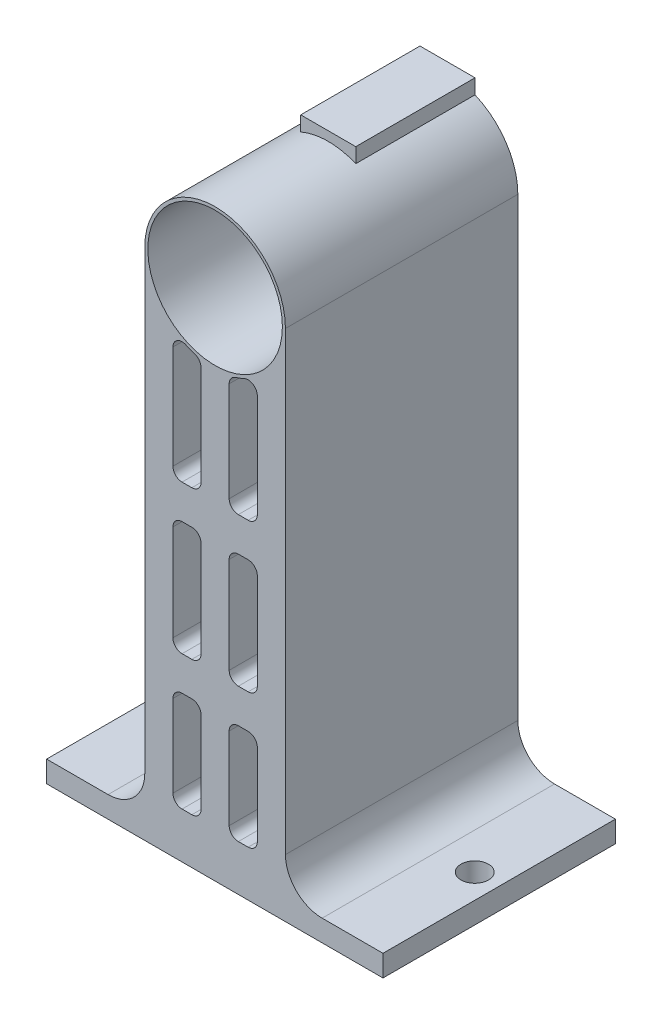
from build123d import *

# Parameters (mm, degrees)
CROQUIS1_R              = 11.5
CROQUIS1_R_2            = 11
SALIENTE_EXTRUIR1_DEPTH = 19
SALIENTE_EXTRUIR2_DEPTH = 0.5
SALIENTE_EXTRUIR3_START = 19
SALIENTE_EXTRUIR3_DEPTH = 19
SALIENTE_EXTRUIR4_START = -38
CROQUIS4_W              = 4.6
CROQUIS4_H              = 16.4
CROQUIS4_H_2            = 18.7
SALIENTE_EXTRUIR4_DEPTH = 38
CROQUIS5_R              = 2.25
CORTAR_EXTRUIR1_DEPTH   = 38
REDONDEO1_R             = 1.5


with BuildPart() as part:
    # Croquis1 → Saliente-Extruir1 (new body)
    with BuildSketch(Plane.XY):
        with Locations((0, 51.625329815)):
            Circle(CROQUIS1_R)
        with Locations((0, 51.625329815)):
            Circle(CROQUIS1_R_2, mode=Mode.SUBTRACT)
    extrude(amount=SALIENTE_EXTRUIR1_DEPTH)

    # Croquis3 → Saliente-Extruir2 (add)
    with BuildSketch(Plane(origin=(0, 0, 0), x_dir=(-1, 0, 0), z_dir=(0, 0, -1))):
        with BuildLine():
            Line((-4.5, 64.625329815), (4.5, 64.625329815))
            Line((4.5, 64.625329815), (4.5, 62.20833506))
            ThreePointArc((4.5, 62.20833506), (0, 63.125329815), (-4.5, 62.20833506))
            Line((-4.5, 62.20833506), (-4.5, 64.625329815))
        make_face()
    extrude(amount=-SALIENTE_EXTRUIR2_DEPTH)

    # Croquis2 → Saliente-Extruir3 (add)
    with BuildSketch(Plane(origin=(0, 0, 0), x_dir=(-1, 0, 0), z_dir=(0, 0, -1)).offset(SALIENTE_EXTRUIR3_START)):
        with BuildLine():
            Line((-4.5, 64.625329815), (4.5, 64.625329815))
            Line((4.5, 64.625329815), (4.5, 62.20833506))
            ThreePointArc((4.5, 62.20833506), (0, 40.125329815), (-4.5, 62.20833506))
            Line((-4.5, 62.20833506), (-4.5, 64.625329815))
        make_face()
        with BuildLine():
            Line((-4, 64.125329815), (4, 64.125329815))
            Line((4, 64.125329815), (4, 61.872280581))
            ThreePointArc((4, 61.872280581), (0, 40.625329815), (-4, 61.872280581))
            Line((-4, 61.872280581), (-4, 64.125329815))
        make_face(mode=Mode.SUBTRACT)
    extrude(amount=-SALIENTE_EXTRUIR3_DEPTH)

    # Croquis4 → Saliente-Extruir4 (add)
    with BuildSketch(Plane.XY.offset(19).offset(SALIENTE_EXTRUIR4_START)):
        with BuildLine():
            ThreePointArc((-6.9, 42.425329815), (-10.285912696, 46.482373467), (-11.5, 51.625329815))
            Line((-11.5, 51.625329815), (-11.5, -22.874670185))
            ThreePointArc((-11.5, -22.874670185), (-13.257359313, -27.117310872), (-17.5, -28.874670185))
            Line((-17.5, -28.874670185), (-27.55, -28.874670185))
            Line((-27.55, -28.874670185), (-27.55, -32.374670185))
            Line((-27.55, -32.374670185), (-11.55, -32.374670185))
            Line((-11.55, -32.374670185), (11.45, -32.374670185))
            Line((11.45, -32.374670185), (27.45, -32.374670185))
            Line((27.45, -32.374670185), (27.45, -28.874670185))
            Line((27.45, -28.874670185), (17.5, -28.874670185))
            ThreePointArc((17.5, -28.874670185), (13.257359313, -27.117310872), (11.5, -22.874670185))
            Line((11.5, -22.874670185), (11.5, 51.625329815))
            ThreePointArc((11.5, 51.625329815), (10.285912696, 46.482373467), (6.9, 42.425329815))
            Line((6.9, 42.425329815), (6.9, 21.425329815))
            Line((6.9, 21.425329815), (2.3, 21.425329815))
            Line((2.3, 21.425329815), (2.3, 40.357676999))
            ThreePointArc((2.3, 40.357676999), (0, 40.125329815), (-2.3, 40.357676999))
            Line((-2.3, 40.357676999), (-2.3, 21.425329815))
            Line((-2.3, 21.425329815), (-6.9, 21.425329815))
            Line((-6.9, 21.425329815), (-6.9, 42.425329815))
        make_face()
        with Locations((-4.6, -16.674670185)):
            Rectangle(CROQUIS4_W, CROQUIS4_H, mode=Mode.SUBTRACT)
        with Locations((-4.6, 6.475329815)):
            Rectangle(CROQUIS4_W, CROQUIS4_H_2, mode=Mode.SUBTRACT)
        with Locations((4.6, -16.674670185)):
            Rectangle(CROQUIS4_W, CROQUIS4_H, mode=Mode.SUBTRACT)
        with Locations((4.6, 6.475329815)):
            Rectangle(CROQUIS4_W, CROQUIS4_H_2, mode=Mode.SUBTRACT)
    extrude(amount=SALIENTE_EXTRUIR4_DEPTH)

    # Croquis5 → Cortar-Extruir1 (cut)
    with BuildSketch(Plane(origin=(0, -28.874670185, 0), x_dir=(1, 0, 0), z_dir=(0, 1, 0))):
        with Locations(Location((-23.55, 0, 0), (0, 0, 180))):
            Circle(CROQUIS5_R)
        with Locations(Location((23.45, 0, 0), (0, 0, 180))):
            Circle(CROQUIS5_R)
    extrude(amount=-CORTAR_EXTRUIR1_DEPTH, mode=Mode.SUBTRACT)

    # Redondeo1
    redondeo1_edges = [part.edges().sort_by_distance(p)[0] for p in [
        (2.3, -8.474670185, 0),
        (2.3, -24.874670185, 0),
        (6.9, -24.874670185, 0),
        (-6.9, -8.474670185, 0),
        (-6.9, -24.874670185, 0),
        (-2.3, -24.874670185, 0),
        (-2.3, -2.874670185, 0),
        (-2.3, 15.825329815, 0),
        (-6.9, 15.825329815, 0),
        (6.9, -2.874670185, 0),
        (6.9, 15.825329815, 0),
        (2.3, 15.825329815, 0),
        (-6.9, 42.425329815, 0),
        (-6.9, 21.425329815, 0),
        (-2.3, 21.425329815, 0),
        (-2.3, 40.357676999, 0),
        (2.3, 40.357676999, 0),
        (2.3, 21.425329815, 0),
        (6.9, 21.425329815, 0),
        (6.9, 42.425329815, 0),
        (-2.3, -8.474670185, 0),
        (-6.9, -2.874670185, 0),
        (2.3, -2.874670185, 0),
        (6.9, -8.474670185, 0),
    ]]
    fillet(redondeo1_edges, radius=REDONDEO1_R)


solid = part.part
